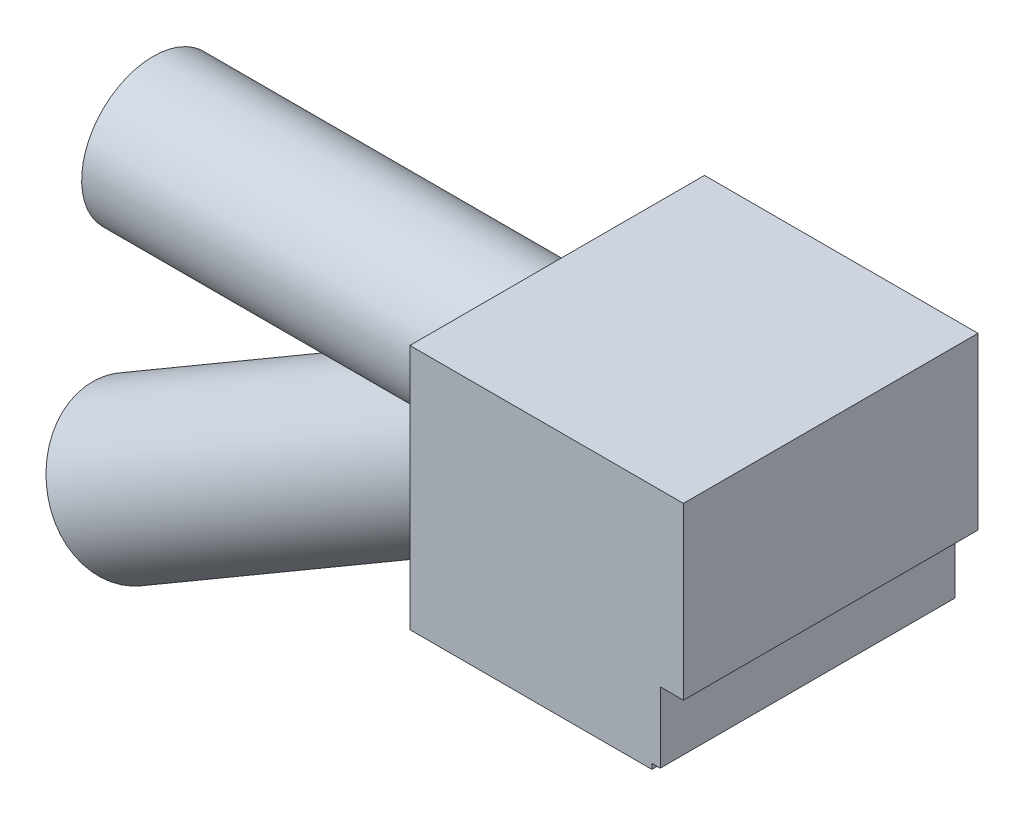
from build123d import *

# Parameters (mm, degrees)
ESQUISSE1_R             = 17
BOSS_EXTRU_1_DEPTH      = 96
ESQUISSE2_W             = 70
ESQUISSE2_H             = 58.5
BOSS_EXTRU_3_DEPTH      = 65
ESQUISSE6_R             = 18
BOSS_EXTRU_4_DEPTH      = 144
ESQUISSE7_W             = 70
ESQUISSE7_H             = 18
ENL_V_MAT_EXTRU_1_DEPTH = 5.5
ESQUISSE8_W             = 70
ESQUISSE8_H             = 1.25
ENL_V_MAT_EXTRU_2_DEPTH = 2
ESQUISSE9_R             = 2.5
BOSS_EXTRU_5_DEPTH      = 120
CONG_1_R                = 1


with BuildPart() as part:
    # Esquisse1 → Boss.-Extru.1 (new body)
    with BuildSketch(Plane(origin=(0, 0, 0), x_dir=(0, 0, -1), z_dir=(1, 0, 0))):
        Circle(ESQUISSE1_R)
    extrude(amount=BOSS_EXTRU_1_DEPTH)

    # Esquisse2 → Boss.-Extru.3 (add)
    with BuildSketch(Plane(origin=(96, 0, 0), x_dir=(0, 0, -1), z_dir=(1, 0, 0))):
        with Locations((0, -6.25)):
            Rectangle(ESQUISSE2_W, ESQUISSE2_H)
    extrude(amount=BOSS_EXTRU_3_DEPTH)

    # Esquisse6 → Boss.-Extru.4 (add)
    with BuildSketch(Plane(origin=(88.685287476, 51.850448358, 0), x_dir=(0, 0, -1), z_dir=(0.8632812499999999, 0.5047231750162041, 0))):
        with Locations(Location((0, -60.062057827, 0), (0, 0, 90))):
            Circle(ESQUISSE6_R)
    extrude(amount=-BOSS_EXTRU_4_DEPTH)

    # Esquisse7 → Enlèv. mat.-Extru.1 (cut)
    with BuildSketch(Plane(origin=(161, 0, 0), x_dir=(0, 0, -1), z_dir=(1, 0, 0))):
        with Locations((0, -26.5)):
            Rectangle(ESQUISSE7_W, ESQUISSE7_H)
    extrude(amount=-ENL_V_MAT_EXTRU_1_DEPTH, mode=Mode.SUBTRACT)

    # Esquisse8 → Enlèv. mat.-Extru.2 (cut)
    with BuildSketch(Plane(origin=(155.5, 0, 0), x_dir=(0, 0, -1), z_dir=(1, 0, 0))):
        with Locations((0, -34.875)):
            Rectangle(ESQUISSE8_W, ESQUISSE8_H)
    extrude(amount=-ENL_V_MAT_EXTRU_2_DEPTH, mode=Mode.SUBTRACT)

    # Esquisse9 → Boss.-Extru.5 (add)
    with BuildSketch(Plane(origin=(-35.627212524, -20.829688844, 0), x_dir=(0, 0, 1), z_dir=(-0.8632812499999999, -0.5047231750162042, 0))):
        with Locations((-19.5, -60.062057827)):
            Circle(ESQUISSE9_R)
    extrude(amount=-BOSS_EXTRU_5_DEPTH)

    # Congé1
    cong_1_edges = [part.edges().sort_by_distance(p)[0] for p in [
        (44.859518924, -41.124048908, -17.897435897),
        (45.827981076, -45.003192614, -17.897435897),
    ]]
    fillet(cong_1_edges, radius=CONG_1_R)


solid = part.part
